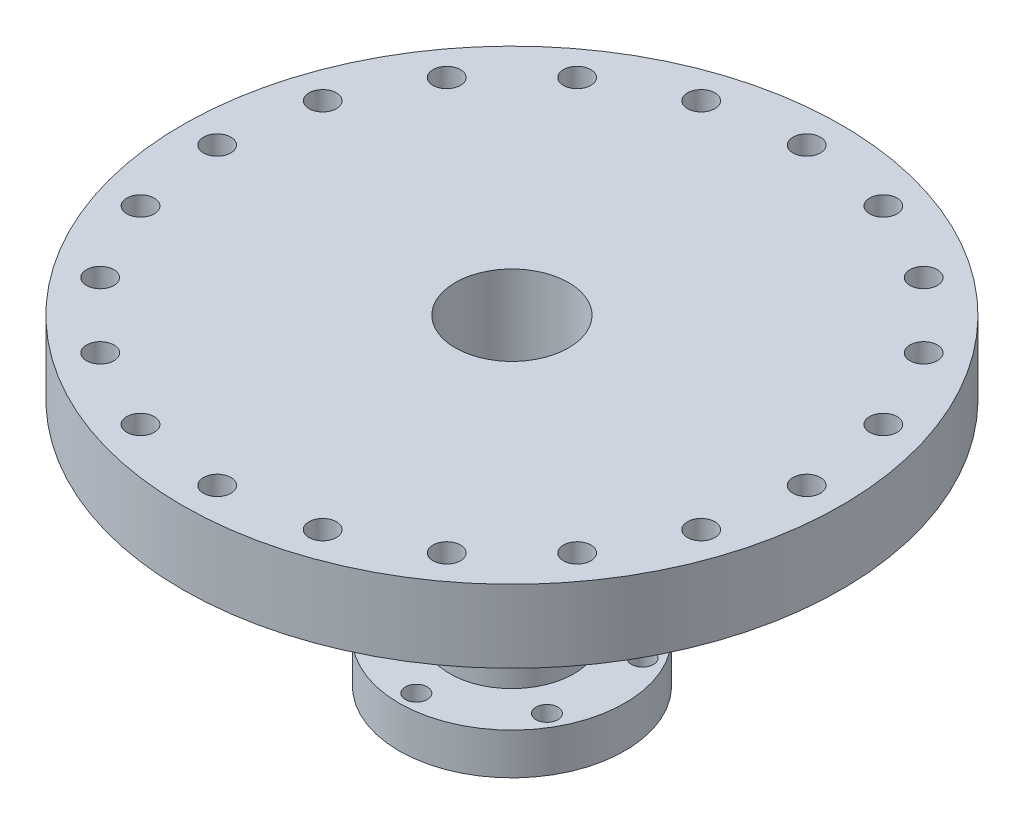
from build123d import *
from build123d.topology import SkipClean

# Parameters (mm, degrees)
SKETCH1_R         = 19.05
SKETCH1_R_2       = 17.399
EXTRUDE1_DEPTH    = 63.5
EXTRUDE2_START    = 12.7
SKETCH2_R         = 34.671
SKETCH2_R_2       = 17.399
EXTRUDE2_DEPTH    = 12.7
SKETCH3_R         = 101.219
SKETCH3_R_2       = 17.399
EXTRUDE3_DEPTH    = 22.352
EXTRUDE4_REACH    = 175.79
SKETCH4_R         = 4.2164
CIRPATTERN1_COUNT = 20
EXTRUDE5_REACH    = 175.79
SKETCH6_R         = 3.3655
CIRPATTERN2_COUNT = 6


with BuildPart() as part:
    # Sketch1 → Extrude1 (new body)
    with BuildSketch(Plane(origin=(0, 0, 0), x_dir=(1, 0, 0), z_dir=(0, 1, 0))):
        with Locations(Location((0, 0, 0), (0, 0, 270))):
            Circle(SKETCH1_R)
        with Locations(Location((0, 0, 0), (0, 0, 270))):
            Circle(SKETCH1_R_2, mode=Mode.SUBTRACT)
    extrude(amount=EXTRUDE1_DEPTH)

    # Sketch2 → Extrude2 (add)
    with SkipClean():  # the faces are left unmerged after this step: merging them gives an invalid solid
        with BuildSketch(Plane.XZ.offset(EXTRUDE2_START)):
            with Locations(Location((0, 0, 0), (0, 0, 270))):
                Circle(SKETCH2_R)
            with Locations(Location((0, 0, 0), (0, 0, 270))):
                Circle(SKETCH2_R_2, mode=Mode.SUBTRACT)
        extrude(amount=-EXTRUDE2_DEPTH)

    # Sketch3 → Extrude3 (add)
    with BuildSketch(Plane(origin=(0, 63.5, 0), x_dir=(1, 0, 0), z_dir=(0, 1, 0))):
        with Locations(Location((0, 0, 0), (0, 0, 270))):
            Circle(SKETCH3_R)
        with Locations(Location((0, 0, 0), (0, 0, 90))):
            Circle(SKETCH3_R_2, mode=Mode.SUBTRACT)
    extrude(amount=EXTRUDE3_DEPTH)

    # Sketch4 → Extrude4 (cut, up to next)
    with BuildSketch(Plane(origin=(0, 85.852, 0), x_dir=(1, 0, 0), z_dir=(0, 1, 0)), mode=Mode.PRIVATE) as extrude4_sk1:
        with Locations(Location((0, 90.5256, 0), (0, 0, 270))):
            Circle(SKETCH4_R)
    extrude4_tool1 = extrude(extrude4_sk1.sketch, amount=-EXTRUDE4_REACH, mode=Mode.PRIVATE) & part.part
    extrude4 = extrude4_tool1.solids().sort_by_distance((0, 85.852, -90.5256))[0]
    add(extrude4, mode=Mode.SUBTRACT)

    # CirPattern1: Extrude4 ×20 about axis
    cirpattern1_axis = Axis((0, 0, 0), (0, 1, 0))
    for i in range(1, CIRPATTERN1_COUNT):
        add(extrude4.rotate(cirpattern1_axis, i * 360 / CIRPATTERN1_COUNT), mode=Mode.SUBTRACT)

    # Sketch6 → Extrude5 (cut, up to next)
    with BuildSketch(Plane.XZ.offset(12.7), mode=Mode.PRIVATE) as extrude5_sk1:
        with Locations(Location((0, 29.3624, 0), (0, 0, 270))):
            Circle(SKETCH6_R)
    extrude5_tool1 = extrude(extrude5_sk1.sketch, amount=-EXTRUDE5_REACH, mode=Mode.PRIVATE) & part.part
    extrude5 = extrude5_tool1.solids().sort_by_distance((0, -12.7, 29.3624))[0]
    add(extrude5, mode=Mode.SUBTRACT)

    # CirPattern2: Extrude5 ×6 about axis
    cirpattern2_axis = Axis((0, 0, 0), (0, 1, 0))
    for i in range(1, CIRPATTERN2_COUNT):
        add(extrude5.rotate(cirpattern2_axis, i * 360 / CIRPATTERN2_COUNT), mode=Mode.SUBTRACT)


solid = part.part
